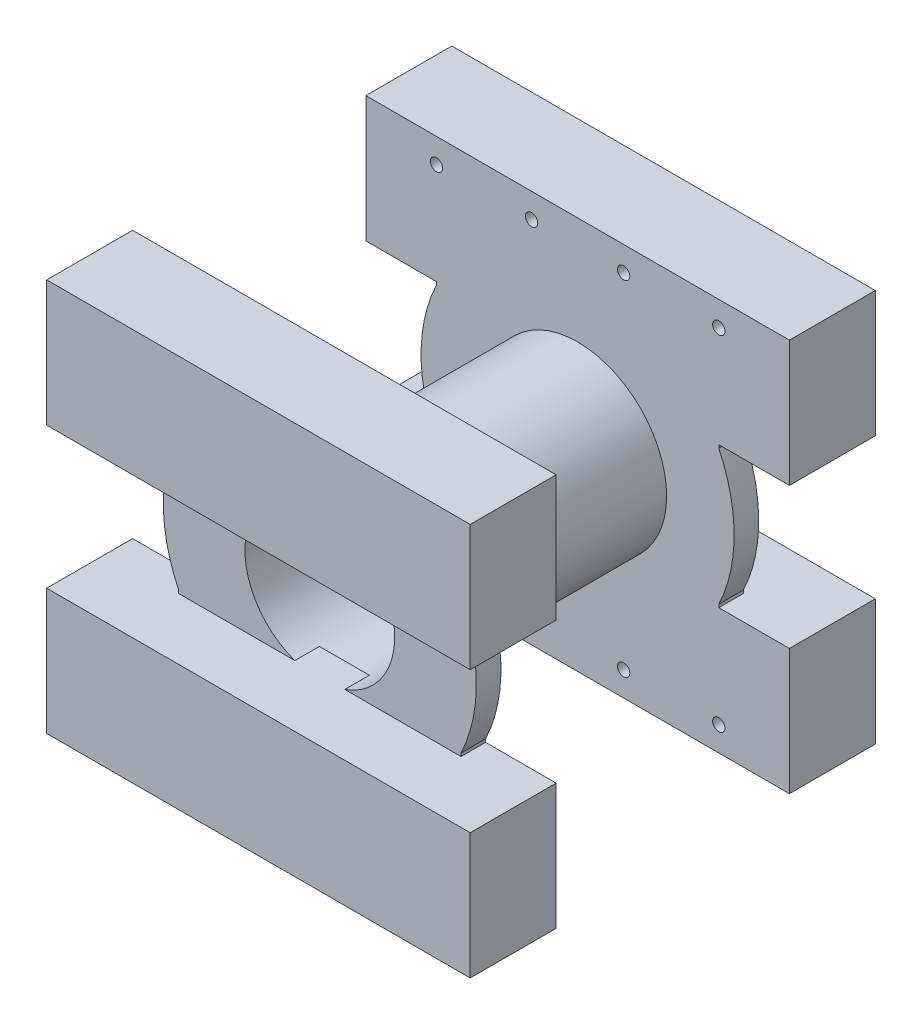
from build123d import *

# Parameters (mm, degrees)
SKETCH1_R           = 7.25
SKETCH1_R_2         = 6.1
BOSS_EXTRUDE1_DEPTH = 1
SKETCH2_R           = 7.25
SKETCH2_R_2         = 6.1
BOSS_EXTRUDE4_DEPTH = 19
BOSS_EXTRUDE5_START = -2
SKETCH3_W           = 34.5
SKETCH3_H           = 10.25
BOSS_EXTRUDE5_DEPTH = 7
SKETCH4_R           = 0.5
CUT_EXTRUDE1_DEPTH  = 10


with BuildPart() as part:
    # Sketch1 → Boss-Extrude1 (new, symmetric)
    # profile 1 of 2: a face of its own
    with BuildSketch(Plane.XY):
        with BuildLine():
            Line((11.5, -16), (11.5, -5.505678886))
            ThreePointArc((11.5, -5.505678886), (12.75, 0), (11.5, 5.505678886))
            Line((11.5, 5.505678886), (11.5, 16))
            Line((11.5, 16), (-11.5, 16))
            Line((-11.5, 16), (-11.5, 5.505678886))
            ThreePointArc((-11.5, 5.505678886), (-12.75, 0), (-11.5, -5.505678886))
            Line((-11.5, -5.505678886), (-11.5, -16))
            Line((-11.5, -16), (11.5, -16))
        make_face()
        Circle(SKETCH1_R, mode=Mode.SUBTRACT)
    # profile 2 of 2: a face of its own
    with BuildSketch(Plane.XY):
        Circle(SKETCH1_R)
        Circle(SKETCH1_R_2, mode=Mode.SUBTRACT)
    boss_extrude1 = extrude(amount=BOSS_EXTRUDE1_DEPTH, both=True)

    # Sketch2 → Boss-Extrude4 (add)
    with BuildSketch(Plane.XY.offset(1)):
        Circle(SKETCH2_R)
        Circle(SKETCH2_R_2, mode=Mode.SUBTRACT)
    extrude(amount=BOSS_EXTRUDE4_DEPTH)

    # Sketch3 → Boss-Extrude5 (add)
    with BuildSketch(Plane(origin=(0, 0, -1), x_dir=(-1, 0, 0), z_dir=(0, 0, -1)).offset(BOSS_EXTRUDE5_START)):
        with Locations((0, 10.875)):
            Rectangle(SKETCH3_W, SKETCH3_H)
        with Locations((0, -10.875)):
            Rectangle(SKETCH3_W, SKETCH3_H)
    boss_extrude5 = extrude(amount=BOSS_EXTRUDE5_DEPTH)

    # Mirror1: Boss-Extrude1, Boss-Extrude5 across plane
    add(boss_extrude1.mirror(Plane.XY.offset(10.5)))
    add(boss_extrude5.mirror(Plane.XY.offset(10.5)))

    # Sketch4 → Cut-Extrude1 (cut)
    with BuildSketch(Plane(origin=(0, 0, -6), x_dir=(-1, 0, 0), z_dir=(0, 0, -1))):
        with Locations((-11.5, 14)):
            Circle(SKETCH4_R)
        with Locations((-3.75, 14)):
            Circle(SKETCH4_R)
        with Locations(Location((3.75, 14, 0), (0, 0, 180))):
            Circle(SKETCH4_R)
        with Locations(Location((11.5, 14, 0), (0, 0, 180))):
            Circle(SKETCH4_R)
        with Locations((3.75, -14)):
            Circle(SKETCH4_R)
        with Locations(Location((-3.75, -14, 0), (0, 0, 180))):
            Circle(SKETCH4_R)
        with Locations(Location((-11.5, -14, 0), (0, 0, 180))):
            Circle(SKETCH4_R)
        with Locations((11.5, -14)):
            Circle(SKETCH4_R)
    extrude(amount=-CUT_EXTRUDE1_DEPTH, mode=Mode.SUBTRACT)


solid = part.part
